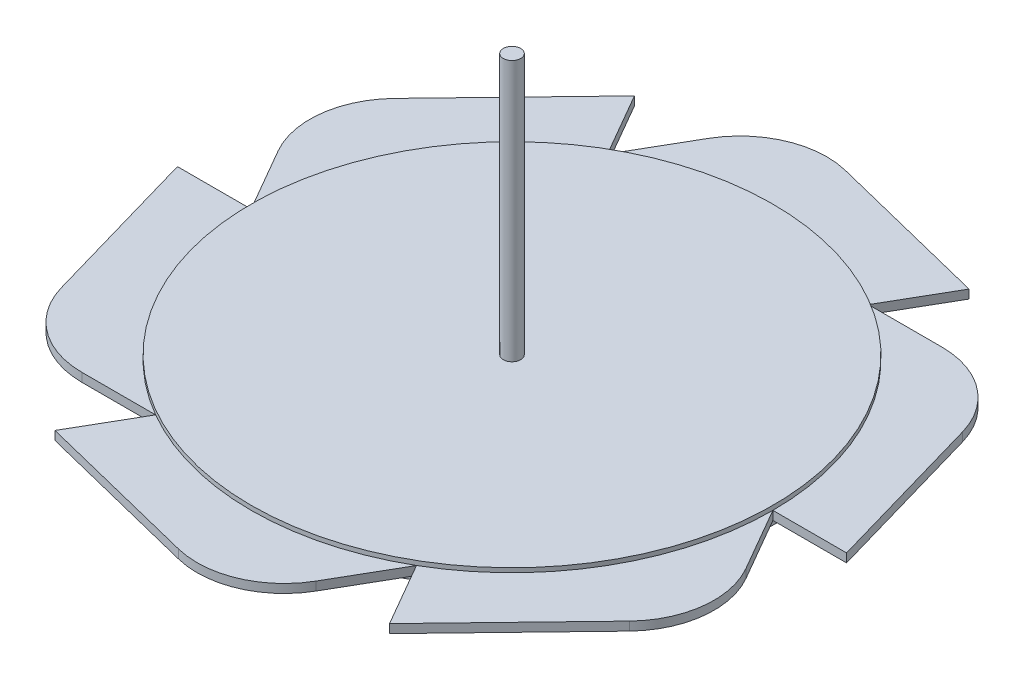
from build123d import *

# Parameters (mm, degrees)
BOSS_EXTRUDE1_DEPTH = 0.5
BOSS_EXTRUDE3_DEPTH = 0.25
SKETCH2_R           = 0.5
BOSS_EXTRUDE4_DEPTH = 15


with BuildPart() as part:
    # Sketch1 → Boss-Extrude1 (new, symmetric)
    with BuildSketch(Plane(origin=(0, 0, 0), x_dir=(1, 0, 0), z_dir=(0, 1, 0))):
        with BuildLine():
            ThreePointArc((7.500000000000017, 12.990381056766571), (5.088e-14, 15), (-7.499999999999927, 12.990381056766621))
            ThreePointArc((-7.499999999999927, 12.990381056766621), (-12.990381056766557, 7.50000000000004), (-15, 1.84e-15))
            ThreePointArc((-15, 1.84e-15), (-12.990381056766612, -7.499999999999944), (-7.50000000000011, -12.990381056766516))
            ThreePointArc((-7.50000000000011, -12.990381056766516), (-1.0934e-13, -15), (7.49999999999992, -12.990381056766626))
            ThreePointArc((7.49999999999992, -12.990381056766626), (12.990381056766555, -7.500000000000042), (15, -3.67e-15))
            ThreePointArc((15, 0), (12.990381056766584, 7.499999999999992), (7.500000000000017, 12.990381056766571))
        make_face()
    extrude(amount=BOSS_EXTRUDE1_DEPTH, both=True)

    # Sketch1<3> → Boss-Extrude3 (add, symmetric)
    with BuildSketch(Plane(origin=(0, 0, 0), x_dir=(1, 0, 0), z_dir=(0, 1, 0))):
        with BuildLine():
            ThreePointArc((-15, 1.84e-15), (-12.990381056766557, 7.50000000000004), (-7.499999999999927, 12.990381056766621))
            Line((-7.499999999999832, 12.990381056766678), (-9.617524600200108, 16.658041250590582))
            Line((-9.617524600200108, 16.658041250590582), (-16.3865947350982, 9.638363270713926))
            ThreePointArc((-16.3865947350982, 9.638363270713926), (-17.750347235183938, 6.775221493443607), (-17.117524600200266, 3.6676601938240703))
            Line((-17.117524600200266, 3.6676601938240703), (-14.999999999999993, 1.6046e-13))
        make_face()
        with BuildLine():
            Line((-5.3824753997997234, 16.65804125059047), (-7.500000000000018, 12.99038105676657))
            ThreePointArc((-7.499999999999927, 12.990381056766621), (5.088e-14, 15), (7.500000000000017, 12.990381056766571))
            Line((7.500000000000018, 12.99038105676657), (9.617524600200294, 16.658041250590472))
            Line((9.617524600200294, 16.658041250590472), (0.15377007579180893, 19.010388957472337))
            ThreePointArc((0.15377007579180857, 19.010388957472337), (-3.0076596880036788, 18.75986237838593), (-5.3824753997997234, 16.65804125059047))
        make_face()
        with BuildLine():
            Line((11.735049200400615, 12.99038105676657), (7.500000000000014, 12.990381056766573))
            ThreePointArc((7.500000000000017, 12.990381056766571), (12.990381056766584, 7.499999999999992), (15, 0))
            Line((15.000000000000002, -5.551e-14), (19.235049200400596, -4.163e-14))
            Line((19.235049200400596, -4.086e-14), (16.540364810890143, 9.372025686758565))
            ThreePointArc((16.540364810890143, 9.372025686758565), (14.742687547180363, 11.984640884942497), (11.735049200400615, 12.99038105676657))
        make_face()
        with BuildLine():
            ThreePointArc((-7.50000000000011, -12.990381056766516), (-12.990381056766612, -7.499999999999944), (-15, 1.84e-15))
            Line((-14.999999999999993, 1.6046e-13), (-19.23504920040059, 1.7521e-13))
            Line((-19.23504920040059, 1.7586e-13), (-16.5403648108902, -9.37202568675845))
            ThreePointArc((-16.5403648108902, -9.37202568675845), (-14.742687547180438, -11.984640884942392), (-11.735049200400697, -12.990381056766488))
            Line((-11.735049200400697, -12.990381056766488), (-7.500000000000109, -12.990381056766518))
        make_face()
        with BuildLine():
            Line((17.117524600200298, -3.6676601938239486), (15.000000000000002, -5.551e-14))
            ThreePointArc((15, -3.67e-15), (12.990381056766555, -7.500000000000042), (7.49999999999992, -12.990381056766626))
            Line((7.499999999999927, -12.990381056766628), (9.617524600200229, -16.65804125059051))
            Line((9.617524600200229, -16.65804125059051), (16.38659473509827, -9.638363270713809))
            ThreePointArc((16.38659473509827, -9.638363270713809), (17.75034723518399, -6.775221493443482), (17.117524600200298, -3.6676601938239486))
        make_face()
        with BuildLine():
            ThreePointArc((7.49999999999992, -12.990381056766626), (-1.0934e-13, -15), (-7.50000000000011, -12.990381056766516))
            Line((-7.500000000000109, -12.990381056766518), (-9.617524600200412, -16.658041250590404))
            Line((-9.617524600200412, -16.658041250590404), (-0.15377007579194168, -19.010388957472337))
            ThreePointArc((-0.15377007579194157, -19.010388957472337), (3.007659688003548, -18.759862378385947), (5.382475399799607, -16.658041250590504))
            Line((5.382475399799607, -16.658041250590504), (7.499999999999927, -12.990381056766628))
        make_face()
    extrude(amount=BOSS_EXTRUDE3_DEPTH, both=True)

    # Sketch2 → Boss-Extrude4 (add)
    with BuildSketch(Plane(origin=(0, 0.5, 0), x_dir=(1, 0, 0), z_dir=(0, 1, 0))):
        Circle(SKETCH2_R)
    extrude(amount=BOSS_EXTRUDE4_DEPTH)


solid = part.part
